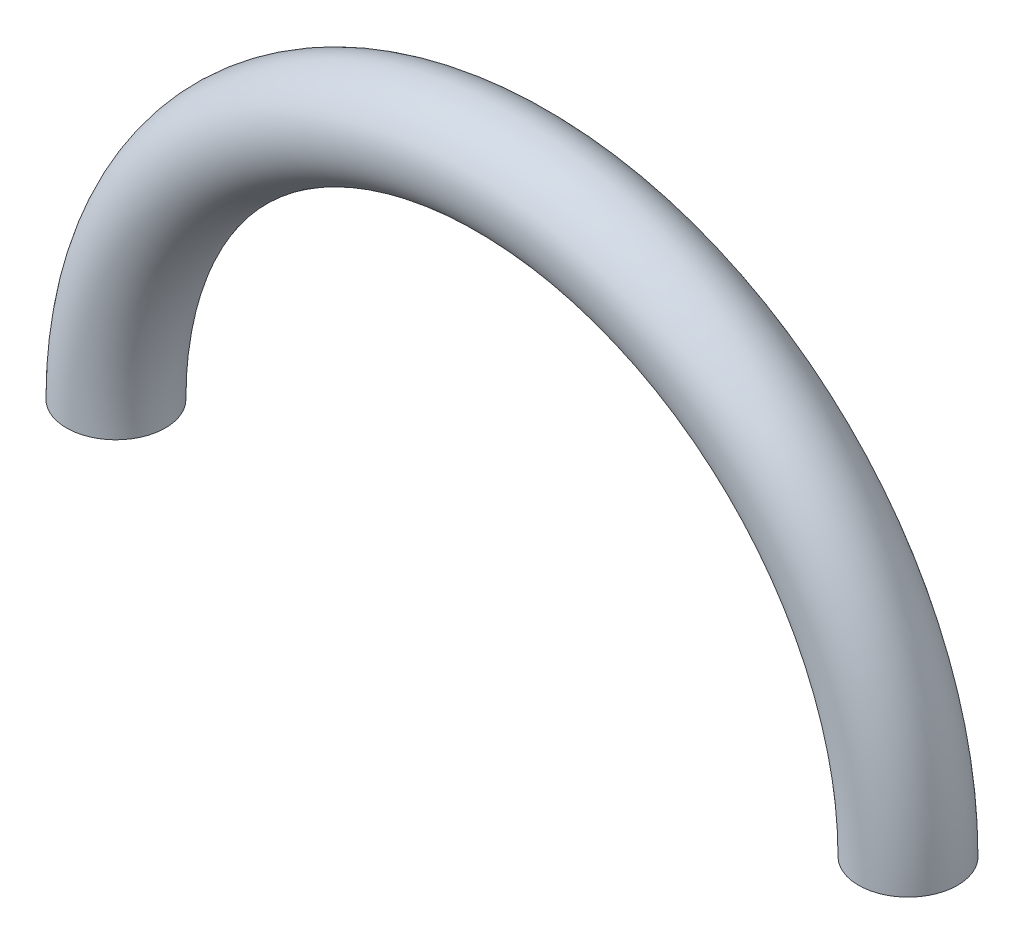
from build123d import *

# Parameters (mm, degrees)
SKETCH1_R      = 15.875
SKETCH1_R_2    = 12.7
REVOLVE1_ANGLE = 180
SKETCH2_R      = 12.69
REVOLVE2_ANGLE = 180


with BuildPart() as part:
    # Sketch1 → Revolve1 (revolve)
    with BuildSketch(Plane(origin=(0, 0, 0), x_dir=(1, 0, 0), z_dir=(0, 1, 0))):
        with Locations((127, 0)):
            Circle(SKETCH1_R)
        with Locations((127, 0)):
            Circle(SKETCH1_R_2, mode=Mode.SUBTRACT)
    revolve(axis=Axis((0, 0, 0), (0, 0, 1)), revolution_arc=REVOLVE1_ANGLE)


with BuildPart() as body_2:
    # Sketch2 → Revolve2 (revolve)
    with BuildSketch(Plane.XZ):
        with Locations((127, 0)):
            Circle(SKETCH2_R)
    revolve(axis=Axis((0, 0, 0), (0, 0, 1)), revolution_arc=REVOLVE2_ANGLE)


solid = Compound([part.part, body_2.part])
